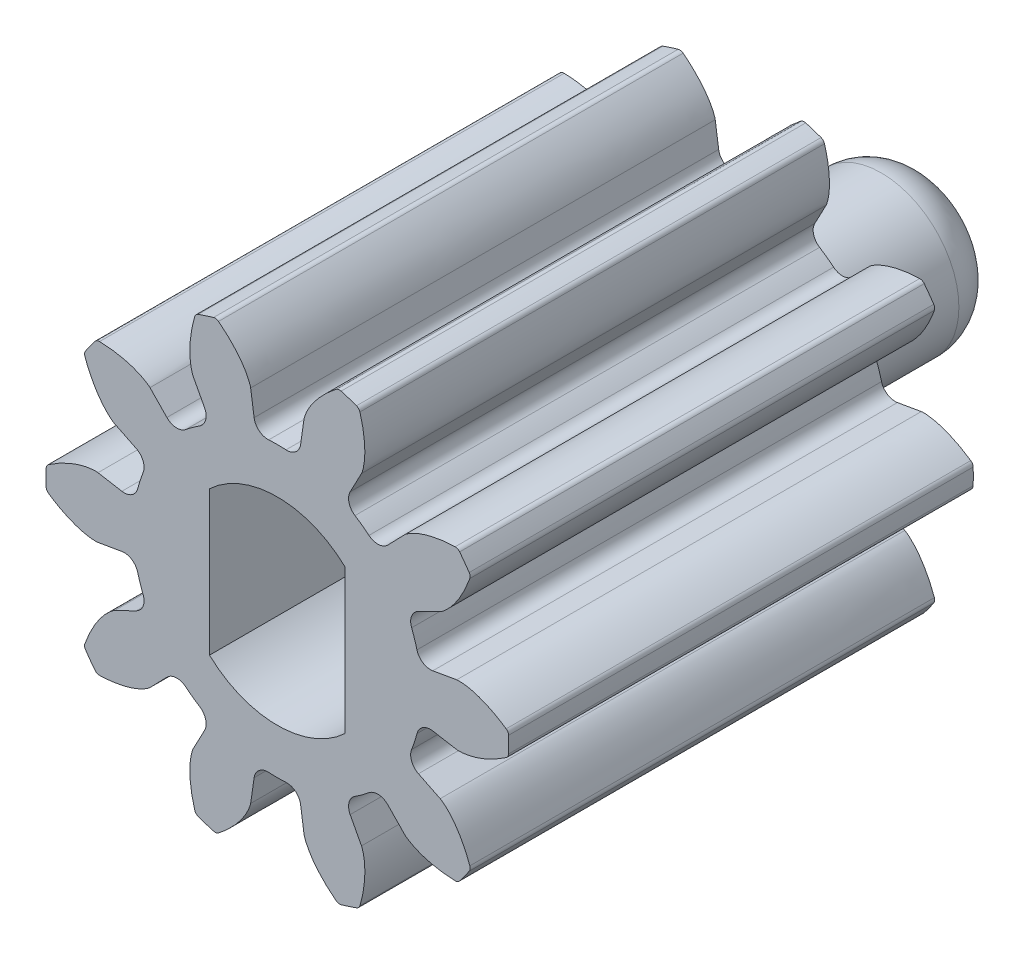
from build123d import *

# Parameters (mm, degrees)
SKETCH1_R                                 = 6.35
BOSS_EXTRUDE1_DEPTH                       = 12.7
CUT_EXTRUDE_DCLTBC_DEPTH                  = 16.554259867
FILLET_TIP_DCLTBC_R                       = 0.177538081
FILLET_ROOT_DCLTBC_R                      = 0.355076163
CIRPATTERN_DCLTBC_COUNT                   = 10
FILLET_TIP_DCLTBC_OF_CIRPATTERN_DCLTBC_R  = 0.177538081
FILLET_ROOT_DCLTBC_OF_CIRPATTERN_DCLTBC_R = 0.355076163
SKETCH4_R                                 = 2.7051
CUT_EXTRUDE2_DEPTH                        = 16.458216095
BOSS_EXTRUDE2_DEPTH                       = 12.7
BOSS_EXTRUDE3_DEPTH                       = 3.175
SKETCH7_R                                 = 2.1209
BOSS_EXTRUDE4_DEPTH                       = 5.08
FILLET1_R                                 = 1.27
SKETCH8_OUTSIDE_W                         = 19.708
SKETCH8_OUTSIDE_H                         = 19.23
CUT_EXTRUDE3_DEPTH                        = 20.844264721


with BuildPart() as part:
    # Sketch1 → Boss-Extrude1 (new body)
    with BuildSketch(Plane.XY):
        Circle(SKETCH1_R)
    extrude(amount=BOSS_EXTRUDE1_DEPTH)

    # DCLTBC → Cut-Extrude-DCLTBC (cut, through all)
    with BuildSketch(Plane.XY):
        with BuildLine():
            Line((-0.704592769, 4.922367749), (-0.562358973, 3.92870576))
            ThreePointArc((-0.562358973, 3.92870576), (0, 3.96875), (0.562358973, 3.92870576))
            Line((0.562358973, 3.92870576), (0.704592769, 4.922367749))
            add(Edge.make_bspline(
                [(0.704592769, 4.922367749), (0.704959911, 4.924657652), (0.706108696, 4.931060486), (0.708749985, 4.9430835), (0.713722219, 4.962562731), (0.72102673, 4.987160391), (0.731572349, 5.01866565), (0.745406167, 5.05537935), (0.762074788, 5.095269011), (0.781776183, 5.138134197), (0.802804874, 5.18039699), (0.82504792, 5.222061634), (0.848339645, 5.263102092), (0.87787829, 5.312237624), (0.915131441, 5.370333793), (0.961301537, 5.436965609), (1.016733636, 5.510974525), (1.076438178, 5.584628915), (1.137804354, 5.65561363), (1.202739614, 5.72552362), (1.267642643, 5.791874617), (1.337964359, 5.858824087), (1.404363156, 5.919628028), (1.481874196, 5.98546848), (1.545347028, 6.037944392), (1.613447979, 6.090182881), (1.646963442, 6.115313985), (1.664246535, 6.128032594)],
                knots=[0, 0, 0, 0, 0, 0.005376749, 0.015083688, 0.02853182, 0.046610139, 0.064854849, 0.092110525, 0.119476176, 0.146842496, 0.174208854, 0.201574956, 0.228941013, 0.256307345, 0.307035032, 0.361767352, 0.41649966, 0.471231936, 0.525964282, 0.580696615, 0.635428982, 0.690161387, 0.744893688, 0.799626082, 0.854358408, 0.909090915, 0.909090915, 0.909090915, 0.909090915, 0.909090915], degree=4))
            ThreePointArc((1.664246535, 6.128032594), (0, 6.35), (-1.664246535, 6.128032594))
            add(Edge.make_bspline(
                [(-0.704592769, 4.922367749), (-0.704959911, 4.924657652), (-0.706108696, 4.931060486), (-0.708749985, 4.9430835), (-0.713722219, 4.962562731), (-0.72102673, 4.987160391), (-0.731572349, 5.01866565), (-0.745406167, 5.05537935), (-0.762074788, 5.095269011), (-0.781776183, 5.138134197), (-0.802804874, 5.18039699), (-0.82504792, 5.222061634), (-0.848339645, 5.263102092), (-0.87787829, 5.312237624), (-0.915131441, 5.370333793), (-0.961301537, 5.436965609), (-1.016733636, 5.510974525), (-1.076438178, 5.584628915), (-1.137804354, 5.65561363), (-1.202739614, 5.72552362), (-1.267642643, 5.791874617), (-1.337964359, 5.858824087), (-1.404363156, 5.919628028), (-1.481874196, 5.98546848), (-1.545347028, 6.037944392), (-1.613447979, 6.090182881), (-1.646963442, 6.115313985), (-1.664246535, 6.128032594)],
                knots=[0, 0, 0, 0, 0, 0.005376749, 0.015083688, 0.02853182, 0.046610139, 0.064854849, 0.092110525, 0.119476176, 0.146842496, 0.174208854, 0.201574956, 0.228941013, 0.256307345, 0.307035032, 0.361767352, 0.41649966, 0.471231936, 0.525964282, 0.580696615, 0.635428982, 0.690161387, 0.744893688, 0.799626082, 0.854358408, 0.909090915, 0.909090915, 0.909090915, 0.909090915, 0.909090915], degree=4))
        make_face()
    cut_extrude_dcltbc = extrude(amount=CUT_EXTRUDE_DCLTBC_DEPTH, mode=Mode.SUBTRACT)

    # Fillet-Tip-DCLTBC
    fillet_tip_dcltbc_edges = [part.edges().sort_by_distance(p)[0] for p in [
        (1.664246535, 6.128032594, 6.35),
        (-1.664246535, 6.128032594, 6.35),
    ]]
    fillet(fillet_tip_dcltbc_edges, radius=FILLET_TIP_DCLTBC_R)

    # Fillet-Root-DCLTBC
    fillet_root_dcltbc_edges = [part.edges().sort_by_distance(p)[0] for p in [
        (0.562358973, 3.92870576, 6.35),
        (-0.562358973, 3.92870576, 6.35),
    ]]
    fillet(fillet_root_dcltbc_edges, radius=FILLET_ROOT_DCLTBC_R)

    # CirPattern-DCLTBC: Cut-Extrude-DCLTBC ×10 about axis
    cirpattern_dcltbc_axis = Axis((0, 0, 12.7), (0, 0, 1))
    for i in range(1, CIRPATTERN_DCLTBC_COUNT):
        add(cut_extrude_dcltbc.rotate(cirpattern_dcltbc_axis, i * 360 / CIRPATTERN_DCLTBC_COUNT), mode=Mode.SUBTRACT)

    # Fillet-Tip-DCLTBC of CirPattern-DCLTBC
    fillet_tip_dcltbc_of_cirpattern_dcltbc_edges = [part.edges().sort_by_distance(p)[0] for p in [
        (-2.255563455, 5.93590208, 6.35),
        (-4.948370914, 3.979462941, 6.35),
        (-5.313824869, 3.476458725, 6.35),
        (-6.342385793, 0.310873702, 6.35),
        (-6.342385793, -0.310873702, 6.35),
        (-5.313824869, -3.476458725, 6.35),
        (-4.948370914, -3.979462941, 6.35),
        (-2.255563455, -5.93590208, 6.35),
        (-1.664246535, -6.128032594, 6.35),
        (1.664246535, -6.128032594, 6.35),
        (2.255563455, -5.93590208, 6.35),
        (4.948370914, -3.979462941, 6.35),
        (5.313824869, -3.476458725, 6.35),
        (6.342385793, -0.310873702, 6.35),
        (6.342385793, 0.310873702, 6.35),
        (5.313824869, 3.476458725, 6.35),
        (4.948370914, 3.979462941, 6.35),
        (2.255563455, 5.93590208, 6.35),
    ]]
    fillet(fillet_tip_dcltbc_of_cirpattern_dcltbc_edges, radius=FILLET_TIP_DCLTBC_OF_CIRPATTERN_DCLTBC_R)

    # Fillet-Root-DCLTBC of CirPattern-DCLTBC
    fillet_root_dcltbc_of_cirpattern_dcltbc_edges = [part.edges().sort_by_distance(p)[0] for p in [
        (-1.854277341, 3.508936036, 6.35),
        (-2.764193272, 2.847843415, 6.35),
        (-3.562642734, 1.748872011, 6.35),
        (-3.910199693, 0.67920168, 6.35),
        (-3.910199693, -0.67920168, 6.35),
        (-3.562642734, -1.748872011, 6.35),
        (-2.764193272, -2.847843415, 6.35),
        (-1.854277341, -3.508936036, 6.35),
        (-0.562358973, -3.92870576, 6.35),
        (0.562358973, -3.92870576, 6.35),
        (1.854277341, -3.508936036, 6.35),
        (2.764193272, -2.847843415, 6.35),
        (3.562642734, -1.748872011, 6.35),
        (3.910199693, -0.67920168, 6.35),
        (3.910199693, 0.67920168, 6.35),
        (3.562642734, 1.748872011, 6.35),
        (2.764193272, 2.847843415, 6.35),
        (1.854277341, 3.508936036, 6.35),
    ]]
    fillet(fillet_root_dcltbc_of_cirpattern_dcltbc_edges, radius=FILLET_ROOT_DCLTBC_OF_CIRPATTERN_DCLTBC_R)

    # Sketch4 → Cut-Extrude2 (cut, through all)
    with BuildSketch(Plane.XY.offset(12.7)):
        Circle(SKETCH4_R)
    extrude(amount=-CUT_EXTRUDE2_DEPTH, mode=Mode.SUBTRACT)

    # Sketch5 → Boss-Extrude2 (add, through all)
    with BuildSketch(Plane.XY.offset(12.7)):
        with BuildLine():
            Line((-1.8542, -1.969646763), (-1.8542, 1.969646763))
            ThreePointArc((-1.8542, 1.969646763), (-2.7051, 0), (-1.8542, -1.969646763))
        make_face()
        with BuildLine():
            ThreePointArc((2.7051, 0), (2.483280334, 1.072792988), (1.8542, 1.969646763))
            Line((1.8542, 1.969646763), (1.8542, -1.969646763))
            ThreePointArc((1.8542, -1.969646763), (2.483280334, -1.072792988), (2.7051, 0))
        make_face()
    extrude(amount=-BOSS_EXTRUDE2_DEPTH)

    # Sketch6 → Boss-Extrude3 (add)
    with BuildSketch(Plane(origin=(0, 0, 0), x_dir=(-1, 0, 0), z_dir=(0, 0, -1))):
        with BuildLine():
            Line((-1.965452, 2.087825569), (-1.965452, -2.087825569))
            ThreePointArc((-1.965452, -2.087825569), (0, -2.867406), (1.965452, -2.087825569))
            Line((1.965452, -2.087825569), (1.965452, 2.087825569))
            ThreePointArc((1.965452, 2.087825569), (0, 2.867406), (-1.965452, 2.087825569))
        make_face()
    extrude(amount=-BOSS_EXTRUDE3_DEPTH)

    # Sketch7 → Boss-Extrude4 (add)
    with BuildSketch(Plane(origin=(0, 0, 0), x_dir=(-1, 0, 0), z_dir=(0, 0, -1))):
        with Locations(Location((0, 0, 0), (0, 0, 180))):
            Circle(SKETCH7_R)
    extrude(amount=BOSS_EXTRUDE4_DEPTH)

    # Fillet1
    fillet1_edges = [part.edges().sort_by_distance(p)[0] for p in [
        (-2.1209, 0, -5.08),
    ]]
    fillet(fillet1_edges, radius=FILLET1_R)

    # Sketch8 outside → Cut-Extrude3 (cut, through all)
    with BuildSketch(Plane.XY.offset(12.7)):
        Rectangle(SKETCH8_OUTSIDE_W, SKETCH8_OUTSIDE_H)
        with BuildLine():
            Line((0.729705005, 4.918548722), (0.635746454, 4.262143265))
            ThreePointArc((0.635746454, 4.262143265), (0.499628672, 4.021246207), (0.23630887, 3.936263119))
            ThreePointArc((0.23630887, 3.936263119), (0, 3.94335), (-0.23630887, 3.936263119))
            ThreePointArc((-0.23630887, 3.936263119), (-0.499628672, 4.021246207), (-0.635746454, 4.262143265))
            Line((-0.635746454, 4.262143265), (-0.729705005, 4.918548722))
            add(Edge.make_bspline(
                [(-0.729705005, 4.918548722), (-0.734668329, 4.949223448), (-0.744482801, 4.978118404), (-0.764795952, 5.035657298), (-0.776283502, 5.063938442), (-0.81358842, 5.147739115), (-0.842202617, 5.202048246), (-0.934443465, 5.359023795), (-1.005000626, 5.457088122), (-1.235817715, 5.737368487), (-1.415061714, 5.905139204), (-1.608238546, 6.053953612)],
                knots=[0, 0, 0, 0, 0.0625, 0.0625, 0.125, 0.125, 0.25, 0.25, 0.5, 0.5, 1, 1, 1, 1], degree=3))
            ThreePointArc((-1.608238546, 6.053953612), (-1.672560711, 6.082871128), (-1.743011846, 6.079677201))
            ThreePointArc((-1.743011846, 6.079677201), (-1.954408883, 6.015052043), (-2.163418392, 5.943078834))
            ThreePointArc((-2.163418392, 5.943078834), (-2.222291901, 5.904252637), (-2.257332337, 5.843050254))
            add(Edge.make_bspline(
                [(-2.257332337, 5.843050254), (-2.326061849, 5.609392256), (-2.372443623, 5.369101857), (-2.394547537, 5.005647223), (-2.393919211, 4.883253154), (-2.376143436, 4.702148217), (-2.367429449, 4.64214294), (-2.348433035, 4.552906394), (-2.341082292, 4.52319786), (-2.323664931, 4.464686448), (-2.31458349, 4.435560198), (-2.300706652, 4.408099344)],
                knots=[0, 0, 0, 0, 0.5, 0.5, 0.75, 0.75, 0.875, 0.875, 0.9375, 0.9375, 1, 1, 1, 1], degree=3))
            Line((-2.300706652, 4.408099344), (-1.990895269, 3.821828724))
            ThreePointArc((-1.990895269, 3.821828724), (-1.95942113, 3.546930885), (-2.122499519, 3.323402626))
            ThreePointArc((-2.122499519, 3.323402626), (-2.317842975, 3.190237165), (-2.504855302, 3.045604889))
            ThreePointArc((-2.504855302, 3.045604889), (-2.767837302, 2.959582155), (-3.01955464, 3.074463944))
            Line((-3.01955464, 3.074463944), (-3.481394152, 3.550279664))
            add(Edge.make_bspline(
                [(-3.481394152, 3.550279664), (-3.503439716, 3.572178669), (-3.52836382, 3.589786377), (-3.578618018, 3.62439655), (-3.60453488, 3.640524264), (-3.683971993, 3.686393152), (-3.739043471, 3.713511159), (-3.905935796, 3.786289236), (-4.020658504, 3.824152484), (-4.372138117, 3.915233182), (-4.615762711, 3.945605564), (-4.859516966, 3.952452456)],
                knots=[0, 0, 0, 0, 0.0625, 0.0625, 0.125, 0.125, 0.25, 0.25, 0.5, 0.5, 1, 1, 1, 1], degree=3))
            ThreePointArc((-4.859516966, 3.952452456), (-4.92855198, 3.938039598), (-4.983670802, 3.894045518))
            ThreePointArc((-4.983670802, 3.894045518), (-5.116708883, 3.717506607), (-5.243496337, 3.53642635))
            ThreePointArc((-5.243496337, 3.53642635), (-5.26830454, 3.470410316), (-5.26067899, 3.400300298))
            add(Edge.make_bspline(
                [(-5.26067899, 3.400300298), (-5.178941608, 3.170868812), (-5.075226098, 2.949207273), (-4.879475267, 2.642173943), (-4.807025512, 2.543524382), (-4.686193797, 2.407455749), (-4.643873816, 2.364032413), (-4.576053469, 2.303004343), (-4.552644355, 2.283290292), (-4.504161269, 2.246191233), (-4.479694249, 2.227965539), (-4.452326566, 2.213905843)],
                knots=[0, 0, 0, 0, 0.5, 0.5, 0.75, 0.75, 0.875, 0.875, 0.9375, 0.9375, 1, 1, 1, 1], degree=3))
            Line((-4.452326566, 2.213905843), (-3.857082667, 1.921705509))
            ThreePointArc((-3.857082667, 1.921705509), (-3.670038658, 1.717808521), (-3.670585232, 1.441115288))
            ThreePointArc((-3.670585232, 1.441115288), (-3.750348714, 1.218562165), (-3.816632146, 0.991629108))
            ThreePointArc((-3.816632146, 0.991629108), (-3.978826159, 0.767458312), (-4.249995584, 0.712443893))
            Line((-4.249995584, 0.712443893), (-4.903309061, 0.825924443))
            add(Edge.make_bspline(
                [(-4.903309061, 0.825924443), (-4.93401621, 0.830683053), (-4.964529785, 0.830277967), (-5.025529633, 0.828739509), (-5.055976448, 0.826553554), (-5.147203478, 0.816970301), (-5.207696804, 0.806539027), (-5.385493412, 0.76732088), (-5.500561491, 0.730520575), (-5.838450362, 0.597611875), (-6.053399237, 0.478984704), (-6.254625074, 0.341248801)],
                knots=[0, 0, 0, 0, 0.0625, 0.0625, 0.125, 0.125, 0.25, 0.25, 0.5, 0.5, 1, 1, 1, 1], degree=3))
            ThreePointArc((-6.254625074, 0.341248801), (-6.302003908, 0.28901079), (-6.320736901, 0.221020801))
            ThreePointArc((-6.320736901, 0.221020801), (-6.3246, 0), (-6.320736901, -0.221020801))
            ThreePointArc((-6.320736901, -0.221020801), (-6.302003908, -0.28901079), (-6.254625074, -0.341248801))
            add(Edge.make_bspline(
                [(-6.254625074, -0.341248801), (-6.053641698, -0.478818744), (-5.839444705, -0.597184249), (-5.500609292, -0.730519979), (-5.384011452, -0.767744253), (-5.206277405, -0.806802989), (-5.146516225, -0.817058145), (-5.055777012, -0.826567091), (-5.025251013, -0.828756561), (-4.964221093, -0.830272688), (-4.933714063, -0.83063623), (-4.903309061, -0.825924443)],
                knots=[0, 0, 0, 0, 0.5, 0.5, 0.75, 0.75, 0.875, 0.875, 0.9375, 0.9375, 1, 1, 1, 1], degree=3))
            Line((-4.903309061, -0.825924443), (-4.249995584, -0.712443893))
            ThreePointArc((-4.249995584, -0.712443893), (-3.978826159, -0.767458312), (-3.816632146, -0.991629108))
            ThreePointArc((-3.816632146, -0.991629108), (-3.750348714, -1.218562165), (-3.670585232, -1.441115288))
            ThreePointArc((-3.670585232, -1.441115288), (-3.670038658, -1.717808521), (-3.857082667, -1.921705509))
            Line((-3.857082667, -1.921705509), (-4.452326566, -2.213905843))
            add(Edge.make_bspline(
                [(-4.452326566, -2.213905843), (-4.479966212, -2.228105256), (-4.504414109, -2.246368406), (-4.55285974, -2.283467857), (-4.576206859, -2.30313252), (-4.644378182, -2.364507438), (-4.687186961, -2.4085036), (-4.80797559, -2.544737972), (-4.879436945, -2.642145364), (-5.07467301, -2.948276856), (-5.178843002, -3.170592032), (-5.26067899, -3.400300298)],
                knots=[0, 0, 0, 0, 0.0625, 0.0625, 0.125, 0.125, 0.25, 0.25, 0.5, 0.5, 1, 1, 1, 1], degree=3))
            ThreePointArc((-5.26067899, -3.400300298), (-5.26830454, -3.470410316), (-5.243496337, -3.53642635))
            ThreePointArc((-5.243496337, -3.53642635), (-5.116708883, -3.717506607), (-4.983670802, -3.894045518))
            ThreePointArc((-4.983670802, -3.894045518), (-4.92855198, -3.938039598), (-4.859516966, -3.952452456))
            add(Edge.make_bspline(
                [(-4.859516966, -3.952452456), (-4.616056416, -3.945613814), (-4.37319391, -3.915471685), (-4.020697527, -3.824180098), (-3.904488013, -3.785760677), (-3.73774, -3.712890408), (-3.68336436, -3.686060263), (-3.604365576, -3.64041799), (-3.578382586, -3.624246577), (-3.528117187, -3.589600662), (-3.503222796, -3.571963192), (-3.481394152, -3.550279664)],
                knots=[0, 0, 0, 0, 0.5, 0.5, 0.75, 0.75, 0.875, 0.875, 0.9375, 0.9375, 1, 1, 1, 1], degree=3))
            Line((-3.481394152, -3.550279664), (-3.01955464, -3.074463944))
            ThreePointArc((-3.01955464, -3.074463944), (-2.767837302, -2.959582155), (-2.504855302, -3.045604889))
            ThreePointArc((-2.504855302, -3.045604889), (-2.317842975, -3.190237165), (-2.122499519, -3.323402626))
            ThreePointArc((-2.122499519, -3.323402626), (-1.95942113, -3.546930885), (-1.990895269, -3.821828724))
            Line((-1.990895269, -3.821828724), (-2.300706652, -4.408099344))
            add(Edge.make_bspline(
                [(-2.300706652, -4.408099344), (-2.31472139, -4.435833087), (-2.323765344, -4.4649784), (-2.341152172, -4.523468113), (-2.348481789, -4.553100252), (-2.367558276, -4.642823702), (-2.376331011, -4.703579714), (-2.39397451, -4.884793411), (-2.394533333, -5.005601577), (-2.37254305, -5.368024036), (-2.326144762, -5.609110377), (-2.257332337, -5.843050254)],
                knots=[0, 0, 0, 0, 0.0625, 0.0625, 0.125, 0.125, 0.25, 0.25, 0.5, 0.5, 1, 1, 1, 1], degree=3))
            ThreePointArc((-2.257332337, -5.843050254), (-2.222291901, -5.904252637), (-2.163418392, -5.943078834))
            ThreePointArc((-2.163418392, -5.943078834), (-1.954408883, -6.015052043), (-1.743011846, -6.079677201))
            ThreePointArc((-1.743011846, -6.079677201), (-1.672560711, -6.082871128), (-1.608238546, -6.053953612))
            add(Edge.make_bspline(
                [(-1.608238546, -6.053953612), (-1.415294476, -5.905318514), (-1.236531681, -5.73818202), (-1.005015964, -5.457133399), (-0.933582862, -5.357745197), (-0.841512956, -5.200779887), (-0.813292502, -5.147112645), (-0.776208998, -5.06375295), (-0.764693636, -5.035397583), (-0.744392432, -4.977823189), (-0.734619492, -4.948921621), (-0.729705005, -4.918548722)],
                knots=[0, 0, 0, 0, 0.5, 0.5, 0.75, 0.75, 0.875, 0.875, 0.9375, 0.9375, 1, 1, 1, 1], degree=3))
            Line((-0.729705005, -4.918548722), (-0.635746454, -4.262143265))
            ThreePointArc((-0.635746454, -4.262143265), (-0.499628672, -4.021246207), (-0.23630887, -3.936263119))
            ThreePointArc((-0.23630887, -3.936263119), (0, -3.94335), (0.23630887, -3.936263119))
            ThreePointArc((0.23630887, -3.936263119), (0.499628672, -4.021246207), (0.635746454, -4.262143265))
            Line((0.635746454, -4.262143265), (0.729705005, -4.918548722))
            add(Edge.make_bspline(
                [(0.729705005, -4.918548722), (0.734668329, -4.949223448), (0.744482801, -4.978118404), (0.764795952, -5.035657298), (0.776283502, -5.063938442), (0.81358842, -5.147739115), (0.842202617, -5.202048246), (0.934443465, -5.359023795), (1.005000626, -5.457088122), (1.235817715, -5.737368487), (1.415061714, -5.905139204), (1.608238546, -6.053953612)],
                knots=[0, 0, 0, 0, 0.0625, 0.0625, 0.125, 0.125, 0.25, 0.25, 0.5, 0.5, 1, 1, 1, 1], degree=3))
            ThreePointArc((1.608238546, -6.053953612), (1.672560711, -6.082871128), (1.743011846, -6.079677201))
            ThreePointArc((1.743011846, -6.079677201), (1.954408883, -6.015052043), (2.163418392, -5.943078834))
            ThreePointArc((2.163418392, -5.943078834), (2.222291901, -5.904252637), (2.257332337, -5.843050254))
            add(Edge.make_bspline(
                [(2.257332337, -5.843050254), (2.326061849, -5.609392256), (2.372443623, -5.369101857), (2.394547537, -5.005647223), (2.393919211, -4.883253154), (2.376143436, -4.702148217), (2.367429449, -4.64214294), (2.348433035, -4.552906394), (2.341082292, -4.52319786), (2.323664931, -4.464686448), (2.31458349, -4.435560198), (2.300706652, -4.408099344)],
                knots=[0, 0, 0, 0, 0.5, 0.5, 0.75, 0.75, 0.875, 0.875, 0.9375, 0.9375, 1, 1, 1, 1], degree=3))
            Line((2.300706652, -4.408099344), (1.990895269, -3.821828724))
            ThreePointArc((1.990895269, -3.821828724), (1.95942113, -3.546930885), (2.122499519, -3.323402626))
            ThreePointArc((2.122499519, -3.323402626), (2.317842975, -3.190237165), (2.504855302, -3.045604889))
            ThreePointArc((2.504855302, -3.045604889), (2.767837302, -2.959582155), (3.01955464, -3.074463944))
            Line((3.01955464, -3.074463944), (3.481394152, -3.550279664))
            add(Edge.make_bspline(
                [(3.481394152, -3.550279664), (3.503439716, -3.572178669), (3.52836382, -3.589786377), (3.578618018, -3.62439655), (3.60453488, -3.640524264), (3.683971993, -3.686393152), (3.739043471, -3.713511159), (3.905935796, -3.786289236), (4.020658504, -3.824152484), (4.372138117, -3.915233182), (4.615762711, -3.945605564), (4.859516966, -3.952452456)],
                knots=[0, 0, 0, 0, 0.0625, 0.0625, 0.125, 0.125, 0.25, 0.25, 0.5, 0.5, 1, 1, 1, 1], degree=3))
            ThreePointArc((4.859516966, -3.952452456), (4.92855198, -3.938039598), (4.983670802, -3.894045518))
            ThreePointArc((4.983670802, -3.894045518), (5.116708883, -3.717506607), (5.243496337, -3.53642635))
            ThreePointArc((5.243496337, -3.53642635), (5.26830454, -3.470410316), (5.26067899, -3.400300298))
            add(Edge.make_bspline(
                [(5.26067899, -3.400300298), (5.178941608, -3.170868812), (5.075226098, -2.949207273), (4.879475267, -2.642173943), (4.807025512, -2.543524382), (4.686193797, -2.407455749), (4.643873816, -2.364032413), (4.576053469, -2.303004343), (4.552644355, -2.283290292), (4.504161269, -2.246191233), (4.479694249, -2.227965539), (4.452326566, -2.213905843)],
                knots=[0, 0, 0, 0, 0.5, 0.5, 0.75, 0.75, 0.875, 0.875, 0.9375, 0.9375, 1, 1, 1, 1], degree=3))
            Line((4.452326566, -2.213905843), (3.857082667, -1.921705509))
            ThreePointArc((3.857082667, -1.921705509), (3.670038658, -1.717808521), (3.670585232, -1.441115288))
            ThreePointArc((3.670585232, -1.441115288), (3.750348714, -1.218562165), (3.816632146, -0.991629108))
            ThreePointArc((3.816632146, -0.991629108), (3.978826159, -0.767458312), (4.249995584, -0.712443893))
            Line((4.249995584, -0.712443893), (4.903309061, -0.825924443))
            add(Edge.make_bspline(
                [(4.903309061, -0.825924443), (4.93401621, -0.830683053), (4.964529785, -0.830277967), (5.025529633, -0.828739509), (5.055976448, -0.826553554), (5.147203478, -0.816970301), (5.207696804, -0.806539027), (5.385493412, -0.76732088), (5.500561491, -0.730520575), (5.838450362, -0.597611875), (6.053399237, -0.478984704), (6.254625074, -0.341248801)],
                knots=[0, 0, 0, 0, 0.0625, 0.0625, 0.125, 0.125, 0.25, 0.25, 0.5, 0.5, 1, 1, 1, 1], degree=3))
            ThreePointArc((6.254625074, -0.341248801), (6.302003908, -0.28901079), (6.320736901, -0.221020801))
            ThreePointArc((6.320736901, -0.221020801), (6.3246, 0), (6.320736901, 0.221020801))
            ThreePointArc((6.320736901, 0.221020801), (6.302003908, 0.28901079), (6.254625074, 0.341248801))
            add(Edge.make_bspline(
                [(6.254625074, 0.341248801), (6.053641698, 0.478818744), (5.839444705, 0.597184249), (5.500609292, 0.730519979), (5.384011452, 0.767744253), (5.206277405, 0.806802989), (5.146516225, 0.817058145), (5.055777012, 0.826567091), (5.025251013, 0.828756561), (4.964221093, 0.830272688), (4.933714063, 0.83063623), (4.903309061, 0.825924443)],
                knots=[0, 0, 0, 0, 0.5, 0.5, 0.75, 0.75, 0.875, 0.875, 0.9375, 0.9375, 1, 1, 1, 1], degree=3))
            Line((4.903309061, 0.825924443), (4.249995584, 0.712443893))
            ThreePointArc((4.249995584, 0.712443893), (3.978826159, 0.767458312), (3.816632146, 0.991629108))
            ThreePointArc((3.816632146, 0.991629108), (3.750348714, 1.218562165), (3.670585232, 1.441115288))
            ThreePointArc((3.670585232, 1.441115288), (3.670038658, 1.717808521), (3.857082667, 1.921705509))
            Line((3.857082667, 1.921705509), (4.452326566, 2.213905843))
            add(Edge.make_bspline(
                [(4.452326566, 2.213905843), (4.479966212, 2.228105256), (4.504414109, 2.246368406), (4.55285974, 2.283467857), (4.576206859, 2.30313252), (4.644378182, 2.364507438), (4.687186961, 2.4085036), (4.80797559, 2.544737972), (4.879436945, 2.642145364), (5.07467301, 2.948276856), (5.178843002, 3.170592032), (5.26067899, 3.400300298)],
                knots=[0, 0, 0, 0, 0.0625, 0.0625, 0.125, 0.125, 0.25, 0.25, 0.5, 0.5, 1, 1, 1, 1], degree=3))
            ThreePointArc((5.26067899, 3.400300298), (5.26830454, 3.470410316), (5.243496337, 3.53642635))
            ThreePointArc((5.243496337, 3.53642635), (5.116708883, 3.717506607), (4.983670802, 3.894045518))
            ThreePointArc((4.983670802, 3.894045518), (4.92855198, 3.938039598), (4.859516966, 3.952452456))
            add(Edge.make_bspline(
                [(4.859516966, 3.952452456), (4.616056416, 3.945613814), (4.37319391, 3.915471685), (4.020697527, 3.824180098), (3.904488013, 3.785760677), (3.73774, 3.712890408), (3.68336436, 3.686060263), (3.604365576, 3.64041799), (3.578382586, 3.624246577), (3.528117187, 3.589600662), (3.503222796, 3.571963192), (3.481394152, 3.550279664)],
                knots=[0, 0, 0, 0, 0.5, 0.5, 0.75, 0.75, 0.875, 0.875, 0.9375, 0.9375, 1, 1, 1, 1], degree=3))
            Line((3.481394152, 3.550279664), (3.01955464, 3.074463944))
            ThreePointArc((3.01955464, 3.074463944), (2.767837302, 2.959582155), (2.504855302, 3.045604889))
            ThreePointArc((2.504855302, 3.045604889), (2.317842975, 3.190237165), (2.122499519, 3.323402626))
            ThreePointArc((2.122499519, 3.323402626), (1.95942113, 3.546930885), (1.990895269, 3.821828724))
            Line((1.990895269, 3.821828724), (2.300706652, 4.408099344))
            add(Edge.make_bspline(
                [(2.300706652, 4.408099344), (2.31472139, 4.435833087), (2.323765344, 4.4649784), (2.341152172, 4.523468113), (2.348481789, 4.553100252), (2.367558276, 4.642823702), (2.376331011, 4.703579714), (2.39397451, 4.884793411), (2.394533333, 5.005601577), (2.37254305, 5.368024036), (2.326144762, 5.609110377), (2.257332337, 5.843050254)],
                knots=[0, 0, 0, 0, 0.0625, 0.0625, 0.125, 0.125, 0.25, 0.25, 0.5, 0.5, 1, 1, 1, 1], degree=3))
            ThreePointArc((2.257332337, 5.843050254), (2.222291901, 5.904252637), (2.163418392, 5.943078834))
            ThreePointArc((2.163418392, 5.943078834), (1.954408883, 6.015052043), (1.743011846, 6.079677201))
            ThreePointArc((1.743011846, 6.079677201), (1.672560711, 6.082871128), (1.608238546, 6.053953612))
            add(Edge.make_bspline(
                [(1.608238546, 6.053953612), (1.415294476, 5.905318514), (1.236531681, 5.73818202), (1.005015964, 5.457133399), (0.933582862, 5.357745197), (0.841512956, 5.200779887), (0.813292502, 5.147112645), (0.776208998, 5.06375295), (0.764693636, 5.035397583), (0.744392432, 4.977823189), (0.734619492, 4.948921621), (0.729705005, 4.918548722)],
                knots=[0, 0, 0, 0, 0.5, 0.5, 0.75, 0.75, 0.875, 0.875, 0.9375, 0.9375, 1, 1, 1, 1], degree=3))
        make_face(mode=Mode.SUBTRACT)
    extrude(amount=-CUT_EXTRUDE3_DEPTH, mode=Mode.SUBTRACT)


solid = part.part
